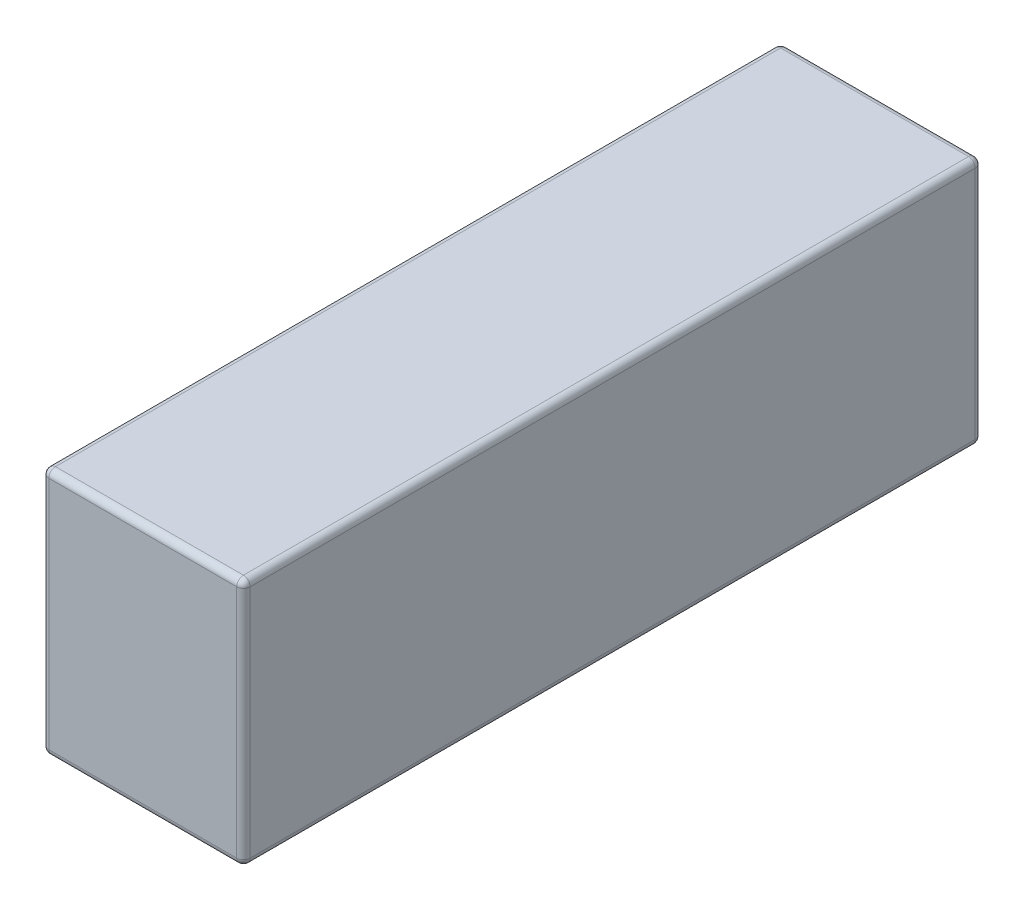
from build123d import *

# Parameters (mm, degrees)
SKETCH1_W           = 30
SKETCH1_H           = 110
BOSS_EXTRUDE1_DEPTH = 37
FILLET1_R           = 1


with BuildPart() as part:
    # Sketch1 → Boss-Extrude1 (new body)
    with BuildSketch(Plane(origin=(0, 0, 0), x_dir=(1, 0, 0), z_dir=(0, 1, 0))):
        with Locations((0, -4.553571429)):
            Rectangle(SKETCH1_W, SKETCH1_H)
    extrude(amount=BOSS_EXTRUDE1_DEPTH)

    # Fillet1
    fillet1_edges = [part.edges().sort_by_distance(p)[0] for p in [
        (15, 37, 4.553571429),
        (0, 37, -50.446428571),
        (-15, 37, 4.553571429),
        (0, 0, -50.446428571),
        (15, 0, 4.553571429),
        (0, 0, 59.553571429),
        (-15, 0, 4.553571429),
        (0, 37, 59.553571429),
        (-15, 18.5, -50.446428571),
        (15, 18.5, -50.446428571),
        (15, 18.5, 59.553571429),
        (-15, 18.5, 59.553571429),
    ]]
    fillet(fillet1_edges, radius=FILLET1_R)


solid = part.part
